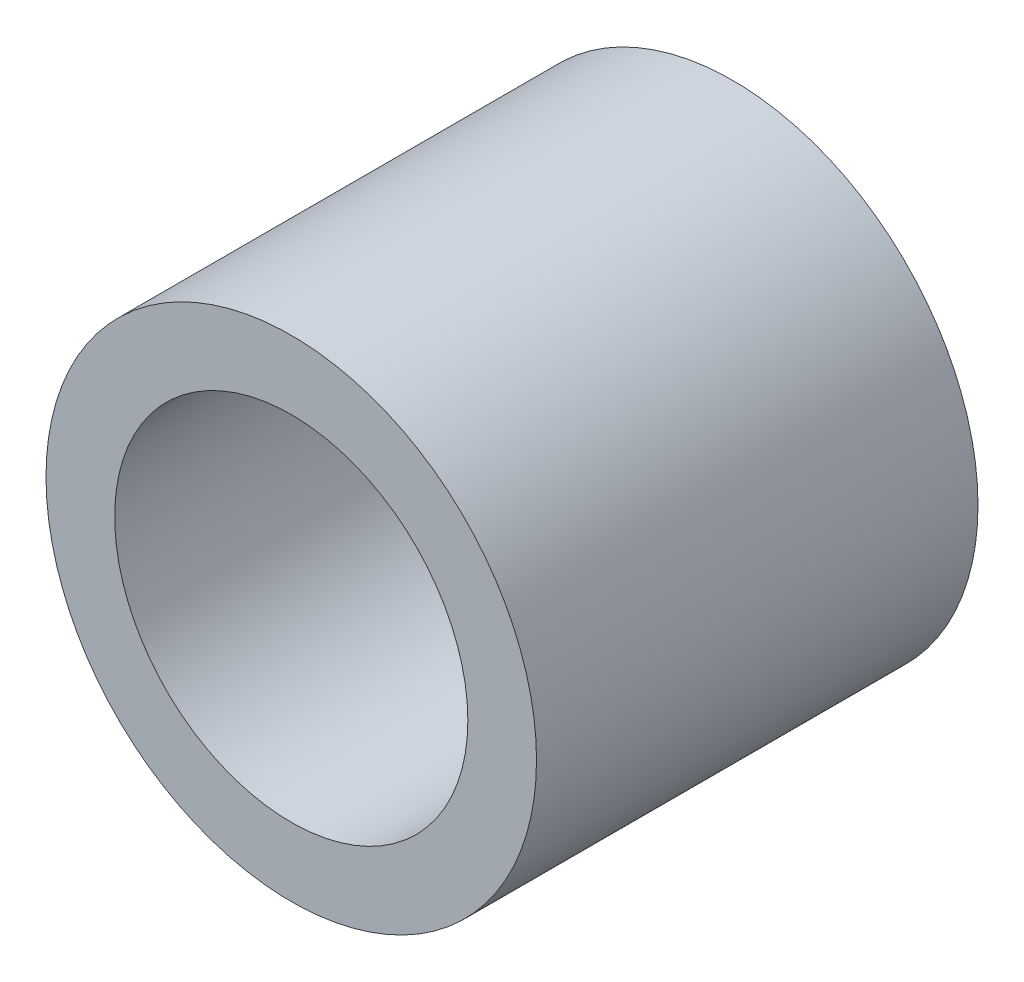
from build123d import *

# Parameters (mm, degrees)
SKETCH1_R           = 6.35
BOSS_EXTRUDE1_DEPTH = 11.43
SKETCH2_R           = 4.572
CUT_EXTRUDE1_DEPTH  = 15.535814391


with BuildPart() as part:
    # Sketch1 → Boss-Extrude1 (new body)
    with BuildSketch(Plane.XY):
        Circle(SKETCH1_R)
    extrude(amount=BOSS_EXTRUDE1_DEPTH)

    # Sketch2 → Cut-Extrude1 (cut, through all)
    with BuildSketch(Plane.XY.offset(11.43)):
        Circle(SKETCH2_R)
    extrude(amount=-CUT_EXTRUDE1_DEPTH, mode=Mode.SUBTRACT)


solid = part.part
